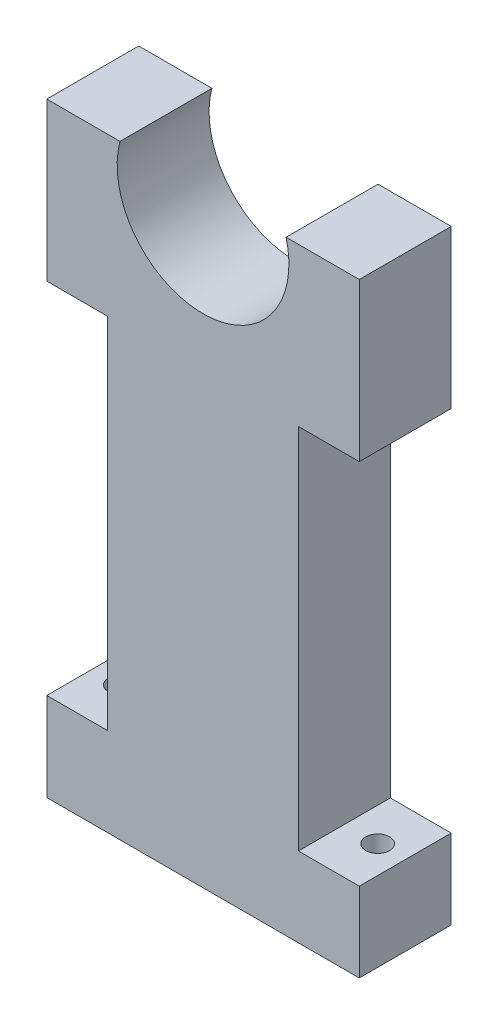
from build123d import *

# Parameters (mm, degrees)
BOSS_EXTRUDE1_DEPTH = 12.7
CUT_EXTRUDE1_REACH  = 96.929
SKETCH2_R           = 1.651


with BuildPart() as part:
    # Sketch1 → Boss-Extrude1 (new body)
    with BuildSketch(Plane.XY):
        with BuildLine():
            Line((0, 0), (43.18, 0))
            Line((43.18, 0), (43.18, 10.990448657))
            Line((43.18, 10.990448657), (34.76788921, 10.990448657))
            Line((34.76788921, 10.990448657), (34.76788921, 61.790448657))
            Line((34.76788921, 61.790448657), (43.18, 61.790448657))
            Line((43.18, 61.790448657), (43.18, 83.580070377))
            Line((43.18, 83.580070377), (33.063937135, 83.580070377))
            ThreePointArc((33.063937135, 83.580070377), (21.59, 68.690045143), (10.116062865, 83.580070377))
            Line((10.116062865, 83.580070377), (0, 83.580070377))
            Line((0, 83.580070377), (0, 61.790448657))
            Line((0, 61.790448657), (8.41211079, 61.790448657))
            Line((8.41211079, 61.790448657), (8.41211079, 12.217122928))
            Line((8.41211079, 12.217122928), (0, 12.217122928))
            Line((0, 12.217122928), (0, 0))
        make_face()
    extrude(amount=BOSS_EXTRUDE1_DEPTH)

    # Sketch2 → Cut-Extrude1 (cut, up to next)
    with BuildSketch(Plane.XZ, mode=Mode.PRIVATE) as cut_extrude1_sk1:
        with Locations(Location((3.81, 6.35, 0), (0, 0, 270))):
            Circle(SKETCH2_R)
    cut_extrude1_tool1 = extrude(cut_extrude1_sk1.sketch, amount=-CUT_EXTRUDE1_REACH, mode=Mode.PRIVATE) & part.part
    # Sketch2 → Cut-Extrude1 (cut, up to next)
    with BuildSketch(Plane.XZ, mode=Mode.PRIVATE) as cut_extrude1_sk2:
        with Locations(Location((39.37, 6.35, 0), (0, 0, 270))):
            Circle(SKETCH2_R)
    cut_extrude1_tool2 = extrude(cut_extrude1_sk2.sketch, amount=-CUT_EXTRUDE1_REACH, mode=Mode.PRIVATE) & part.part
    add(cut_extrude1_tool1.solids().sort_by_distance((3.81, 0, 6.35))[0], mode=Mode.SUBTRACT)
    add(cut_extrude1_tool2.solids().sort_by_distance((39.37, 0, 6.35))[0], mode=Mode.SUBTRACT)


solid = part.part
